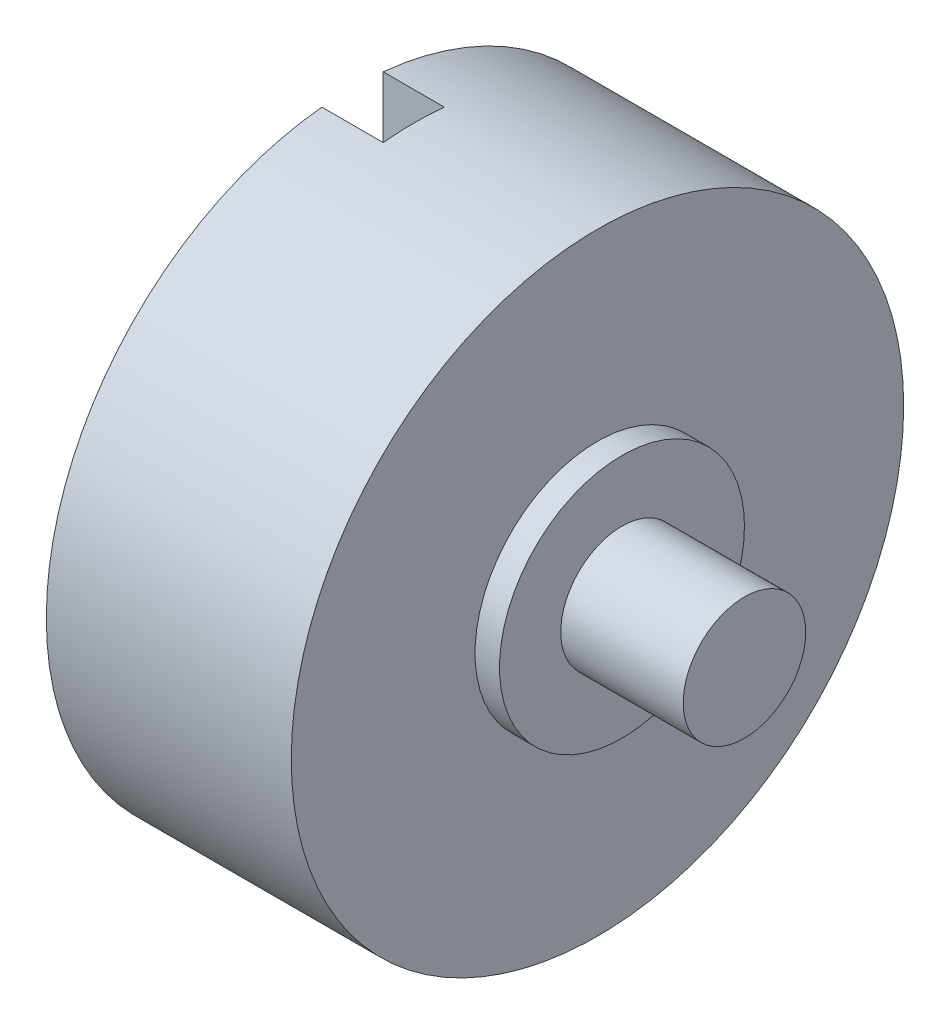
from build123d import *

# Parameters (mm, degrees)
SKETCH1_R           = 25
BOSS_EXTRUDE1_DEPTH = 10
SKETCH2_R           = 5
BOSS_EXTRUDE2_DEPTH = 12
CUT_EXTRUDE1_START  = -5
CUT_EXTRUDE1_DEPTH  = 5
SKETCH4_R           = 10
BOSS_EXTRUDE3_DEPTH = 2


with BuildPart() as part:
    # Sketch1 → Boss-Extrude1 (new, symmetric)
    with BuildSketch(Plane(origin=(0, 0, 0), x_dir=(0, 0, -1), z_dir=(1, 0, 0))):
        Circle(SKETCH1_R)
    extrude(amount=BOSS_EXTRUDE1_DEPTH, both=True)

    # Sketch2 → Boss-Extrude2 (add)
    with BuildSketch(Plane(origin=(10, 0, 0), x_dir=(0, 0, -1), z_dir=(1, 0, 0))):
        Circle(SKETCH2_R)
    extrude(amount=BOSS_EXTRUDE2_DEPTH)

    # Sketch3 → Cut-Extrude1 (cut)
    with BuildSketch(Plane.ZY.offset(10).offset(CUT_EXTRUDE1_START)):
        with BuildLine():
            Line((2.5, 24.874685928), (2.5, -24.874685928))
            ThreePointArc((2.5, -24.874685928), (0, -25), (-2.5, -24.874685928))
            Line((-2.5, -24.874685928), (-2.5, 24.874685928))
            ThreePointArc((-2.5, 24.874685928), (0, 25), (2.5, 24.874685928))
        make_face()
    extrude(amount=CUT_EXTRUDE1_DEPTH, mode=Mode.SUBTRACT)

    # Sketch4 → Boss-Extrude3 (add)
    with BuildSketch(Plane(origin=(10, 0, 0), x_dir=(0, 0, -1), z_dir=(1, 0, 0))):
        Circle(SKETCH4_R)
    extrude(amount=BOSS_EXTRUDE3_DEPTH)


solid = part.part
